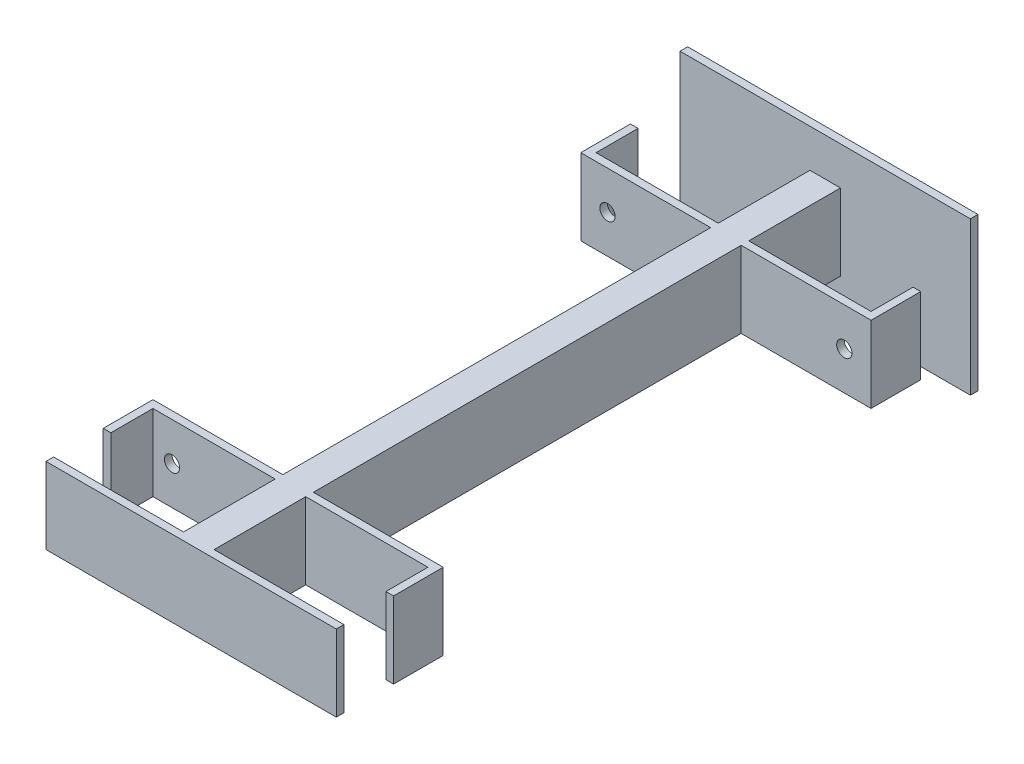
from build123d import *

# Parameters (mm, degrees)
BOSS_EXTRUDE1_DEPTH     = 50
SKETCH2_W               = 190
SKETCH2_H               = 100
BOSS_EXTRUDE2_DEPTH     = 5
SKETCH3_W               = 190
SKETCH3_H               = 50
BOSS_EXTRUDE3_DEPTH     = 5
CUT_EXTRUDE1_DEPTH      = 291
CUT_EXTRUDE1_DEPTH_BACK = 20
SKETCH4_R               = 5
CUT_EXTRUDE2_DEPTH      = 291
CUT_EXTRUDE2_DEPTH_BACK = 21
SKETCH5_R               = 5


with BuildPart() as part:
    # Sketch1 → Boss-Extrude1 (new body)
    with BuildSketch(Plane(origin=(0, 0, 0), x_dir=(1, 0, 0), z_dir=(0, 1, 0))):
        Polygon((-68.351724138, 159.884429765), (-68.351724138, 219.884429765), (-38.351724138, 219.884429765), (-38.351724138, 224.884429765), (-118.351724138, 224.884429765), (-118.351724138, 219.884429765), (-88.351724138, 219.884429765), (-88.351724138, 159.884429765), (-168.351724138, 159.884429765), (-168.351724138, 187.384429765), (-173.351724138, 187.384429765), (-173.351724138, 154.884429765), (-88.351724138, 154.884429765), (-88.351724138, -125.115570235), (-173.351724138, -125.115570235), (-173.351724138, -157.665570235), (-168.351724138, -157.665570235), (-168.351724138, -130.115570235), (-88.351724138, -130.115570235), (-88.351724138, -190.115570235), (-118.351724138, -190.115570235), (-118.351724138, -195.115570235), (-38.351724138, -195.115570235), (-38.351724138, -190.115570235), (-68.351724138, -190.115570235), (-68.351724138, -130.115570235), (11.648275862, -130.115570235), (11.648275862, -157.615570235), (16.648275862, -157.615570235), (16.648275862, -125.115570235), (-68.351724138, -125.115570235), (-68.351724138, 154.884429765), (16.648275862, 154.884429765), (16.648275862, 187.384429765), (11.648275862, 187.384429765), (11.648275862, 159.884429765), align=None)
    extrude(amount=BOSS_EXTRUDE1_DEPTH)

    # Sketch2 → Boss-Extrude2 (add)
    with BuildSketch(Plane(origin=(0, 0, -224.884429765), x_dir=(-1, 0, 0), z_dir=(0, 0, -1))):
        with Locations((78.351724138, 25)):
            Rectangle(SKETCH2_W, SKETCH2_H)
    extrude(amount=-BOSS_EXTRUDE2_DEPTH)

    # Sketch3 → Boss-Extrude3 (add)
    with BuildSketch(Plane.XY.offset(195.115570235)):
        with Locations((-78.351724138, 25)):
            Rectangle(SKETCH3_W, SKETCH3_H)
    extrude(amount=-BOSS_EXTRUDE3_DEPTH)

    # Sketch4 → Cut-Extrude1 (cut, two sides: drawn at the far end of the back side and taken through both)
    with BuildSketch(Plane(origin=(0, 0, 125.115570235), x_dir=(-1, 0, 0), z_dir=(0, 0, -1)).offset(-CUT_EXTRUDE1_DEPTH_BACK)):
        with Locations((155.851724138, 25)):
            Circle(SKETCH4_R)
    extrude(amount=CUT_EXTRUDE1_DEPTH + CUT_EXTRUDE1_DEPTH_BACK, mode=Mode.SUBTRACT)

    # Sketch5 → Cut-Extrude2 (cut, two sides: drawn at the far end of the back side and taken through both)
    with BuildSketch(Plane(origin=(0, 0, 125.115570235), x_dir=(-1, 0, 0), z_dir=(0, 0, -1)).offset(-CUT_EXTRUDE2_DEPTH_BACK)):
        with Locations(Location((0.851724138, 25, 0), (0, 0, 180))):
            Circle(SKETCH5_R)
    extrude(amount=CUT_EXTRUDE2_DEPTH + CUT_EXTRUDE2_DEPTH_BACK, mode=Mode.SUBTRACT)


solid = part.part
